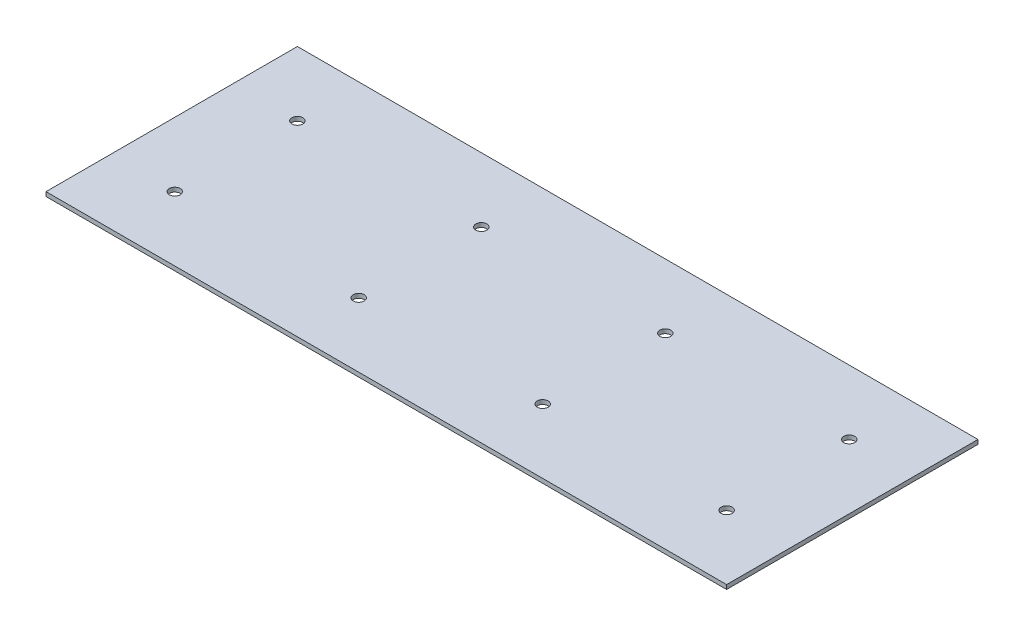
from build123d import *

# Parameters (mm, degrees)
SKETCH1_W           = 255.3
SKETCH1_H           = 94.3
BOSS_EXTRUDE1_DEPTH = 1.6
SKETCH3_R           = 2.05
CUT_EXTRUDE1_DEPTH  = 273.163810967


with BuildPart() as part:
    # Sketch1 → Boss-Extrude1 (new body)
    with BuildSketch(Plane(origin=(0, 0, 0), x_dir=(1, 0, 0), z_dir=(0, 1, 0))):
        with Locations((127.65, 47.15)):
            Rectangle(SKETCH1_W, SKETCH1_H)
    extrude(amount=BOSS_EXTRUDE1_DEPTH)

    # Sketch3 → Cut-Extrude1 (cut, through all)
    with BuildSketch(Plane(origin=(0, 1.6, 0), x_dir=(1, 0, 0), z_dir=(0, 1, 0))):
        with Locations(Location((24.15, 70.15, 0), (0, 0, 270))):
            Circle(SKETCH3_R)
        with Locations(Location((24.15, 24.15, 0), (0, 0, 270))):
            Circle(SKETCH3_R)
        with Locations(Location((93.15, 70.15, 0), (0, 0, 270))):
            Circle(SKETCH3_R)
        with Locations(Location((93.15, 24.15, 0), (0, 0, 270))):
            Circle(SKETCH3_R)
        with Locations(Location((162.15, 24.15, 0), (0, 0, 270))):
            Circle(SKETCH3_R)
        with Locations(Location((162.15, 70.15, 0), (0, 0, 270))):
            Circle(SKETCH3_R)
        with Locations(Location((231.15, 70.15, 0), (0, 0, 270))):
            Circle(SKETCH3_R)
        with Locations(Location((231.15, 24.15, 0), (0, 0, 270))):
            Circle(SKETCH3_R)
    extrude(amount=-CUT_EXTRUDE1_DEPTH, mode=Mode.SUBTRACT)


solid = part.part
